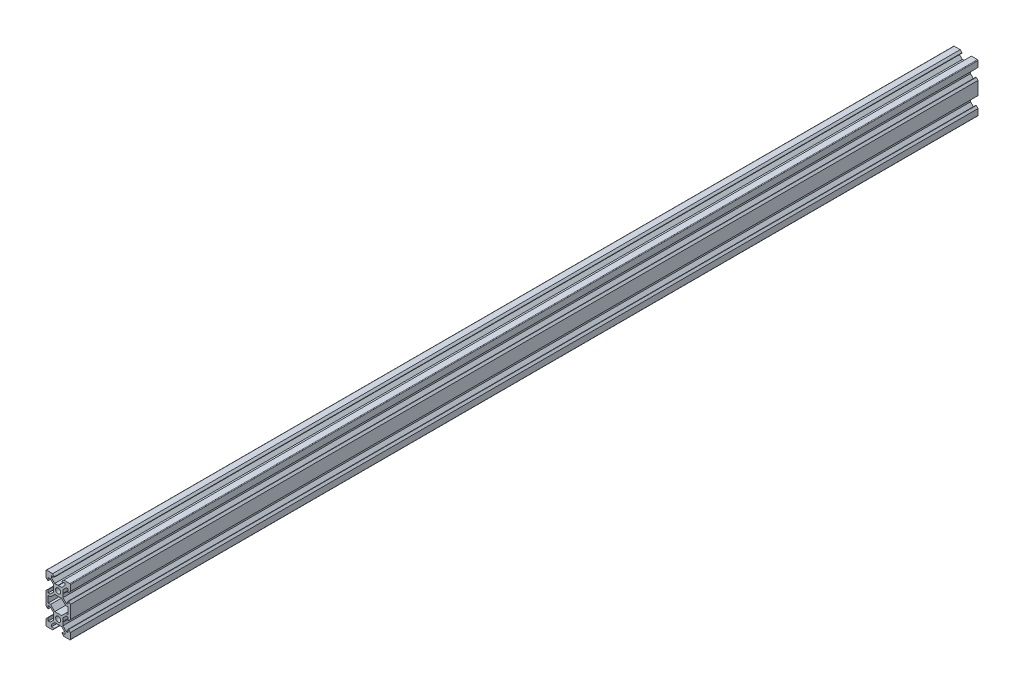
from build123d import *

# Parameters (mm, degrees)
SKETCH2_R           = 2.1
BOSS_EXTRUDE1_DEPTH = 745


with BuildPart() as part:
    # Sketch2 → Boss-Extrude1 (new body)
    with BuildSketch(Plane.XY):
        with BuildLine():
            Line((4.006804208, 10.145798499), (3.796804208, 10.355798499))
            Line((3.796804208, 10.355798499), (4.006804208, 10.565798499))
            Line((4.006804208, 10.565798499), (4.006804208, 13.195138327))
            Line((4.006804208, 13.195138327), (6.66746438, 15.855798499))
            Line((6.66746438, 15.855798499), (8.306804208, 15.855798499))
            Line((8.306804208, 15.855798499), (8.306804208, 13.480798499))
            Line((8.306804208, 13.480798499), (8.651804208, 13.480798499))
            Line((8.651804208, 13.480798499), (10.106804208, 14.935798499))
            Line((10.106804208, 14.935798499), (10.106804208, 19.855798499))
            ThreePointArc((10.106804208, 19.855798499), (9.960357598, 20.209351889), (9.606804208, 20.355798499))
            Line((9.606804208, 20.355798499), (4.686804208, 20.355798499))
            Line((4.686804208, 20.355798499), (3.231804208, 18.900798499))
            Line((3.231804208, 18.900798499), (3.231804208, 18.555798499))
            Line((3.231804208, 18.555798499), (5.606804208, 18.555798499))
            Line((5.606804208, 18.555798499), (5.606804208, 16.91645867))
            Line((5.606804208, 16.91645867), (2.946144036, 14.255798499))
            Line((2.946144036, 14.255798499), (0.316804208, 14.255798499))
            Line((0.316804208, 14.255798499), (0.106804208, 14.045798499))
            Line((0.106804208, 14.045798499), (-0.103195792, 14.255798499))
            Line((-0.103195792, 14.255798499), (-2.73253562, 14.255798499))
            Line((-2.73253562, 14.255798499), (-5.393195792, 16.91645867))
            Line((-5.393195792, 16.91645867), (-5.393195792, 18.555798499))
            Line((-5.393195792, 18.555798499), (-3.018195792, 18.555798499))
            Line((-3.018195792, 18.555798499), (-3.018195792, 18.900798499))
            Line((-3.018195792, 18.900798499), (-4.473195792, 20.355798499))
            Line((-4.473195792, 20.355798499), (-9.393195792, 20.355798499))
            ThreePointArc((-9.393195792, 20.355798499), (-9.746749183, 20.209351889), (-9.893195792, 19.855798499))
            Line((-9.893195792, 19.855798499), (-9.893195792, 14.935798499))
            Line((-9.893195792, 14.935798499), (-8.438195792, 13.480798499))
            Line((-8.438195792, 13.480798499), (-8.093195792, 13.480798499))
            Line((-8.093195792, 13.480798499), (-8.093195792, 15.855798499))
            Line((-8.093195792, 15.855798499), (-6.453855964, 15.855798499))
            Line((-6.453855964, 15.855798499), (-3.793195792, 13.195138327))
            Line((-3.793195792, 13.195138327), (-3.793195792, 10.565798499))
            Line((-3.793195792, 10.565798499), (-3.583195792, 10.355798499))
            Line((-3.583195792, 10.355798499), (-3.793195792, 10.145798499))
            Line((-3.793195792, 10.145798499), (-3.793195792, 7.51645867))
            Line((-3.793195792, 7.51645867), (-6.453855964, 4.855798499))
            Line((-6.453855964, 4.855798499), (-8.093195792, 4.855798499))
            Line((-8.093195792, 4.855798499), (-8.093195792, 7.230798499))
            Line((-8.093195792, 7.230798499), (-8.438195792, 7.230798499))
            Line((-8.438195792, 7.230798499), (-9.893195792, 5.775798499))
            Line((-9.893195792, 5.775798499), (-9.893195792, -5.064201501))
            Line((-9.893195792, -5.064201501), (-8.438195792, -6.519201501))
            Line((-8.438195792, -6.519201501), (-8.093195792, -6.519201501))
            Line((-8.093195792, -6.519201501), (-8.093195792, -4.144201501))
            Line((-8.093195792, -4.144201501), (-6.453855964, -4.144201501))
            Line((-6.453855964, -4.144201501), (-3.793195792, -6.804861673))
            Line((-3.793195792, -6.804861673), (-3.793195792, -9.434201501))
            Line((-3.793195792, -9.434201501), (-3.583195792, -9.644201501))
            Line((-3.583195792, -9.644201501), (-3.793195792, -9.854201501))
            Line((-3.793195792, -9.854201501), (-3.793195792, -12.48354133))
            Line((-3.793195792, -12.48354133), (-6.453855964, -15.144201501))
            Line((-6.453855964, -15.144201501), (-8.093195792, -15.144201501))
            Line((-8.093195792, -15.144201501), (-8.093195792, -12.769201501))
            Line((-8.093195792, -12.769201501), (-8.438195792, -12.769201501))
            Line((-8.438195792, -12.769201501), (-9.893195792, -14.224201501))
            Line((-9.893195792, -14.224201501), (-9.893195792, -19.144201501))
            ThreePointArc((-9.893195792, -19.144201501), (-9.746749183, -19.497754892), (-9.393195792, -19.644201501))
            Line((-9.393195792, -19.644201501), (-4.473195792, -19.644201501))
            Line((-4.473195792, -19.644201501), (-3.018195792, -18.189201501))
            Line((-3.018195792, -18.189201501), (-3.018195792, -17.844201501))
            Line((-3.018195792, -17.844201501), (-5.393195792, -17.844201501))
            Line((-5.393195792, -17.844201501), (-5.393195792, -16.204861673))
            Line((-5.393195792, -16.204861673), (-2.73253562, -13.544201501))
            Line((-2.73253562, -13.544201501), (-0.103195792, -13.544201501))
            Line((-0.103195792, -13.544201501), (0.106804208, -13.334201501))
            Line((0.106804208, -13.334201501), (0.316804208, -13.544201501))
            Line((0.316804208, -13.544201501), (2.946144036, -13.544201501))
            Line((2.946144036, -13.544201501), (5.606804208, -16.204861673))
            Line((5.606804208, -16.204861673), (5.606804208, -17.844201501))
            Line((5.606804208, -17.844201501), (3.231804208, -17.844201501))
            Line((3.231804208, -17.844201501), (3.231804208, -18.189201501))
            Line((3.231804208, -18.189201501), (4.686804208, -19.644201501))
            Line((4.686804208, -19.644201501), (9.606804208, -19.644201501))
            ThreePointArc((9.606804208, -19.644201501), (9.960357598, -19.497754892), (10.106804208, -19.144201501))
            Line((10.106804208, -19.144201501), (10.106804208, -14.224201501))
            Line((10.106804208, -14.224201501), (8.651804208, -12.769201501))
            Line((8.651804208, -12.769201501), (8.306804208, -12.769201501))
            Line((8.306804208, -12.769201501), (8.306804208, -15.144201501))
            Line((8.306804208, -15.144201501), (6.66746438, -15.144201501))
            Line((6.66746438, -15.144201501), (4.006804208, -12.48354133))
            Line((4.006804208, -12.48354133), (4.006804208, -9.854201501))
            Line((4.006804208, -9.854201501), (3.796804208, -9.644201501))
            Line((3.796804208, -9.644201501), (4.006804208, -9.434201501))
            Line((4.006804208, -9.434201501), (4.006804208, -6.804861673))
            Line((4.006804208, -6.804861673), (6.66746438, -4.144201501))
            Line((6.66746438, -4.144201501), (8.306804208, -4.144201501))
            Line((8.306804208, -4.144201501), (8.306804208, -6.519201501))
            Line((8.306804208, -6.519201501), (8.651804208, -6.519201501))
            Line((8.651804208, -6.519201501), (10.106804208, -5.064201501))
            Line((10.106804208, -5.064201501), (10.106804208, 5.775798499))
            Line((10.106804208, 5.775798499), (8.651804208, 7.230798499))
            Line((8.651804208, 7.230798499), (8.306804208, 7.230798499))
            Line((8.306804208, 7.230798499), (8.306804208, 4.855798499))
            Line((8.306804208, 4.855798499), (6.66746438, 4.855798499))
            Line((6.66746438, 4.855798499), (4.006804208, 7.51645867))
            Line((4.006804208, 7.51645867), (4.006804208, 10.145798499))
        make_face()
        with Locations((0.106804208, -9.644201501)):
            Circle(SKETCH2_R, mode=Mode.SUBTRACT)
        with Locations((0.106804208, 10.355798499)):
            Circle(SKETCH2_R, mode=Mode.SUBTRACT)
        Polygon((-6.13253562, -2.344201501), (-2.73253562, -5.744201501), (2.946144036, -5.744201501), (6.346144036, -2.344201501), (8.306804208, -2.344201501), (8.306804208, 3.055798499), (6.346144036, 3.055798499), (2.946144036, 6.455798499), (-2.73253562, 6.455798499), (-6.13253562, 3.055798499), (-8.093195792, 3.055798499), (-8.093195792, -2.344201501), align=None, mode=Mode.SUBTRACT)
    extrude(amount=BOSS_EXTRUDE1_DEPTH)


solid = part.part
